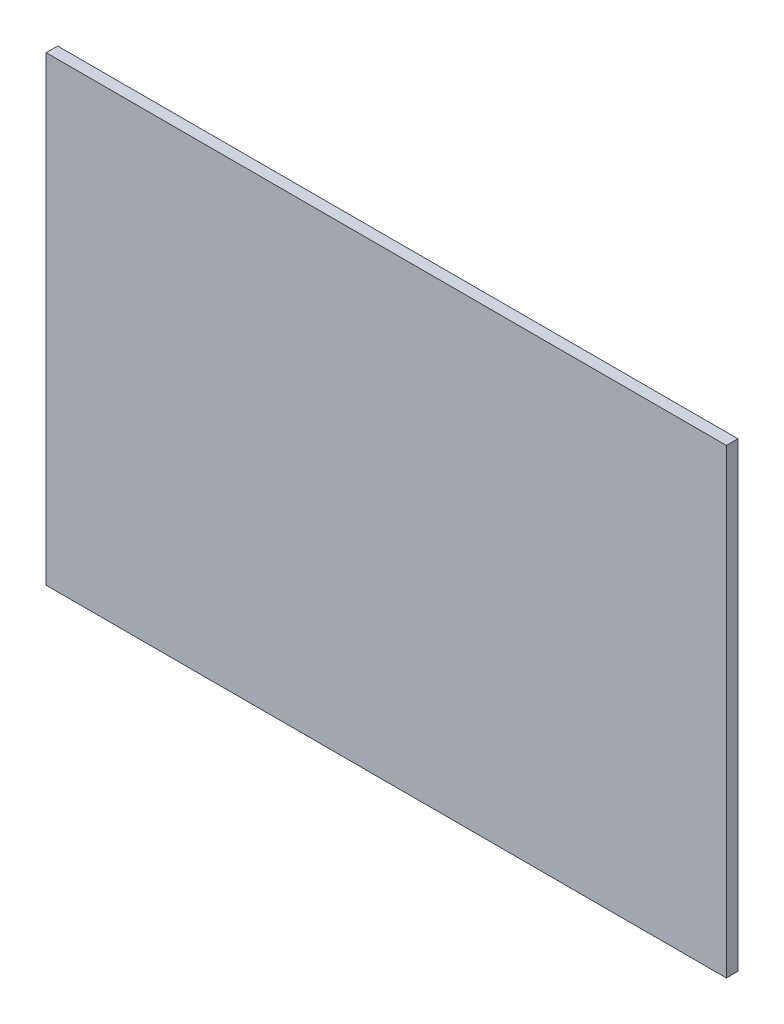
from build123d import *

# Parameters (mm, degrees)
SKETCH1_W           = 295
SKETCH1_H           = 200
BOSS_EXTRUDE1_DEPTH = 5


with BuildPart() as part:
    # Sketch1 → Boss-Extrude1 (new body)
    with BuildSketch(Plane.XY):
        Rectangle(SKETCH1_W, SKETCH1_H)
    extrude(amount=BOSS_EXTRUDE1_DEPTH)


solid = part.part
